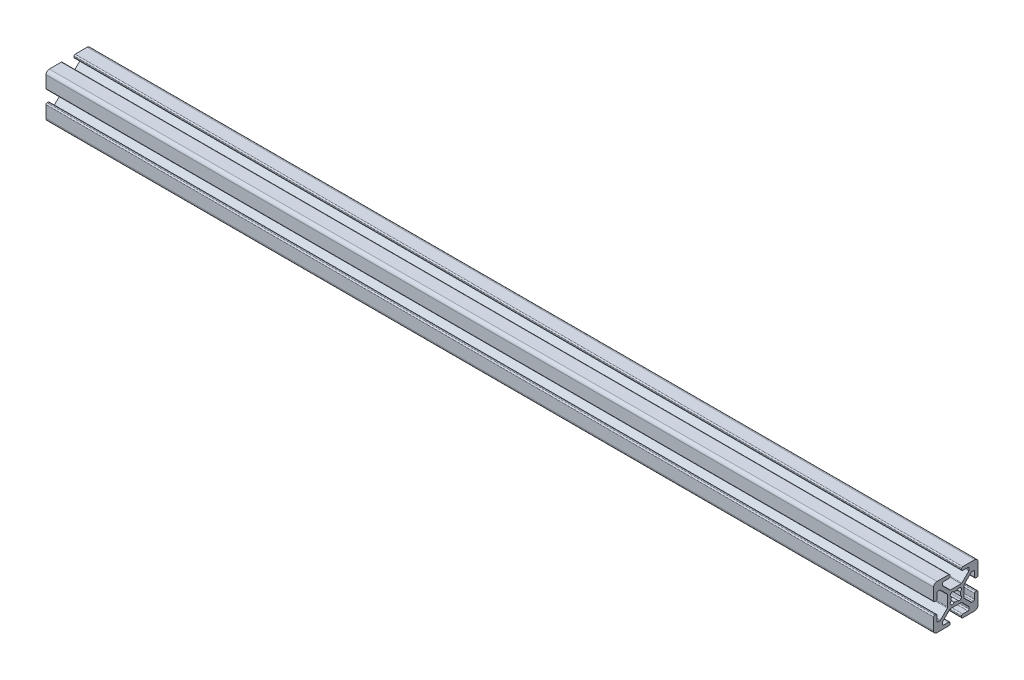
from build123d import *

# Parameters (mm, degrees)
LIB_FEAT_PART_SW_20X20_3_DEPTH = 400


with BuildPart() as part:
    # Sketch1 → Lib feat part (sw) 20X20(3) (new body)
    with BuildSketch(Plane.YZ):
        with BuildLine():
            Line((9.492, 2.63), (9.008, 2.63))
            ThreePointArc((9.008, 2.63), (8.648789755, 2.778789755), (8.5, 3.138))
            Line((8.5, 3.138), (8.5, 5.487))
            ThreePointArc((8.5, 5.487), (8.351210245, 5.846210245), (7.992, 5.995))
            Line((7.992, 5.995), (7.266080661, 5.995))
            ThreePointArc((7.266080661, 5.995), (7.071677478, 5.956330803), (6.906870417, 5.846210245))
            Line((6.906870417, 5.846210245), (3.803789755, 2.743129583))
            ThreePointArc((3.803789755, 2.743129583), (3.693669197, 2.578322522), (3.655, 2.383919339))
            Line((3.655, 2.383919339), (3.655, -2.383919339))
            ThreePointArc((3.655, -2.383919339), (3.693669197, -2.578322522), (3.803789755, -2.743129583))
            Line((3.803789755, -2.743129583), (6.906870417, -5.846210245))
            ThreePointArc((6.906870417, -5.846210245), (7.071677478, -5.956330803), (7.266080661, -5.995))
            Line((7.266080661, -5.995), (7.992, -5.995))
            ThreePointArc((7.992, -5.995), (8.351210245, -5.846210245), (8.5, -5.487))
            Line((8.5, -5.487), (8.5, -3.138))
            ThreePointArc((8.5, -3.138), (8.648789755, -2.778789755), (9.008, -2.63))
            Line((9.008, -2.63), (9.492, -2.63))
            ThreePointArc((9.492, -2.63), (9.851210245, -2.778789755), (10, -3.138))
            Line((10, -3.138), (10, -8.5))
            ThreePointArc((10, -8.5), (9.560660172, -9.560660172), (8.5, -10))
            Line((8.5, -10), (3.138, -10))
            ThreePointArc((3.138, -10), (2.778789755, -9.851210245), (2.63, -9.492))
            Line((2.63, -9.492), (2.63, -9.008))
            ThreePointArc((2.63, -9.008), (2.778789755, -8.648789755), (3.138, -8.5))
            Line((3.138, -8.5), (5.487, -8.5))
            ThreePointArc((5.487, -8.5), (5.846210245, -8.351210245), (5.995, -7.992))
            Line((5.995, -7.992), (5.995, -7.266080661))
            ThreePointArc((5.995, -7.266080661), (5.956330803, -7.071677478), (5.846210245, -6.906870417))
            Line((5.846210245, -6.906870417), (2.743129583, -3.803789755))
            ThreePointArc((2.743129583, -3.803789755), (2.578322522, -3.693669197), (2.383919339, -3.655))
            Line((2.383919339, -3.655), (-2.383919339, -3.655))
            ThreePointArc((-2.383919339, -3.655), (-2.578322522, -3.693669197), (-2.743129583, -3.803789755))
            Line((-2.743129583, -3.803789755), (-5.846210245, -6.906870417))
            ThreePointArc((-5.846210245, -6.906870417), (-5.956330803, -7.071677478), (-5.995, -7.266080661))
            Line((-5.995, -7.266080661), (-5.995, -7.992))
            ThreePointArc((-5.995, -7.992), (-5.846210245, -8.351210245), (-5.487, -8.5))
            Line((-5.487, -8.5), (-3.138, -8.5))
            ThreePointArc((-3.138, -8.5), (-2.778789755, -8.648789755), (-2.63, -9.008))
            Line((-2.63, -9.008), (-2.63, -9.492))
            ThreePointArc((-2.63, -9.492), (-2.778789755, -9.851210245), (-3.138, -10))
            Line((-3.138, -10), (-8.5, -10))
            ThreePointArc((-8.5, -10), (-9.560660172, -9.560660172), (-10, -8.5))
            Line((-10, -8.5), (-10, -3.138))
            ThreePointArc((-10, -3.138), (-9.851210245, -2.778789755), (-9.492, -2.63))
            Line((-9.492, -2.63), (-9.008, -2.63))
            ThreePointArc((-9.008, -2.63), (-8.648789755, -2.778789755), (-8.5, -3.138))
            Line((-8.5, -3.138), (-8.5, -5.487))
            ThreePointArc((-8.5, -5.487), (-8.351210245, -5.846210245), (-7.992, -5.995))
            Line((-7.992, -5.995), (-7.266080661, -5.995))
            ThreePointArc((-7.266080661, -5.995), (-7.071677478, -5.956330803), (-6.906870417, -5.846210245))
            Line((-6.906870417, -5.846210245), (-3.803789755, -2.743129583))
            ThreePointArc((-3.803789755, -2.743129583), (-3.693669197, -2.578322522), (-3.655, -2.383919339))
            Line((-3.655, -2.383919339), (-3.655, 2.383919339))
            ThreePointArc((-3.655, 2.383919339), (-3.693669197, 2.578322522), (-3.803789755, 2.743129583))
            Line((-3.803789755, 2.743129583), (-6.906870417, 5.846210245))
            ThreePointArc((-6.906870417, 5.846210245), (-7.071677478, 5.956330803), (-7.266080661, 5.995))
            Line((-7.266080661, 5.995), (-7.992, 5.995))
            ThreePointArc((-7.992, 5.995), (-8.351210245, 5.846210245), (-8.5, 5.487))
            Line((-8.5, 5.487), (-8.5, 3.138))
            ThreePointArc((-8.5, 3.138), (-8.648789755, 2.778789755), (-9.008, 2.63))
            Line((-9.008, 2.63), (-9.492, 2.63))
            ThreePointArc((-9.492, 2.63), (-9.851210245, 2.778789755), (-10, 3.138))
            Line((-10, 3.138), (-10, 8.5))
            ThreePointArc((-10, 8.5), (-9.560660172, 9.560660172), (-8.5, 10))
            Line((-8.5, 10), (-3.138, 10))
            ThreePointArc((-3.138, 10), (-2.778789755, 9.851210245), (-2.63, 9.492))
            Line((-2.63, 9.492), (-2.63, 9.008))
            ThreePointArc((-2.63, 9.008), (-2.778789755, 8.648789755), (-3.138, 8.5))
            Line((-3.138, 8.5), (-5.487, 8.5))
            ThreePointArc((-5.487, 8.5), (-5.846210245, 8.351210245), (-5.995, 7.992))
            Line((-5.995, 7.992), (-5.995, 7.266080661))
            ThreePointArc((-5.995, 7.266080661), (-5.956330803, 7.071677478), (-5.846210245, 6.906870417))
            Line((-5.846210245, 6.906870417), (-2.743129583, 3.803789755))
            ThreePointArc((-2.743129583, 3.803789755), (-2.578322522, 3.693669197), (-2.383919339, 3.655))
            Line((-2.383919339, 3.655), (2.383919339, 3.655))
            ThreePointArc((2.383919339, 3.655), (2.578322522, 3.693669197), (2.743129583, 3.803789755))
            Line((2.743129583, 3.803789755), (5.846210245, 6.906870417))
            ThreePointArc((5.846210245, 6.906870417), (5.956330803, 7.071677478), (5.995, 7.266080661))
            Line((5.995, 7.266080661), (5.995, 7.992))
            ThreePointArc((5.995, 7.992), (5.846210245, 8.351210245), (5.487, 8.5))
            Line((5.487, 8.5), (3.138, 8.5))
            ThreePointArc((3.138, 8.5), (2.778789755, 8.648789755), (2.63, 9.008))
            Line((2.63, 9.008), (2.63, 9.492))
            ThreePointArc((2.63, 9.492), (2.778789755, 9.851210245), (3.138, 10))
            Line((3.138, 10), (8.5, 10))
            ThreePointArc((8.5, 10), (9.560660172, 9.560660172), (10, 8.5))
            Line((10, 8.5), (10, 3.138))
            ThreePointArc((10, 3.138), (9.851210245, 2.778789755), (9.492, 2.63))
        make_face()
        with BuildLine():
            Line((2.124900844, -2.304505966), (2.304505966, -2.124900844))
            ThreePointArc((2.304505966, -2.124900844), (2.505938017, -1.356467811), (1.935133506, -0.803976718))
            ThreePointArc((1.935133506, -0.803976718), (2.0955, 0), (1.935133506, 0.803976718))
            ThreePointArc((1.935133506, 0.803976718), (2.505938017, 1.356467811), (2.304505966, 2.124900844))
            Line((2.304505966, 2.124900844), (2.124900844, 2.304505966))
            ThreePointArc((2.124900844, 2.304505966), (1.356467811, 2.505938017), (0.803976718, 1.935133506))
            ThreePointArc((0.803976718, 1.935133506), (0, 2.0955), (-0.803976718, 1.935133506))
            ThreePointArc((-0.803976718, 1.935133506), (-1.356467811, 2.505938017), (-2.124900844, 2.304505966))
            Line((-2.124900844, 2.304505966), (-2.304505966, 2.124900844))
            ThreePointArc((-2.304505966, 2.124900844), (-2.505938017, 1.356467811), (-1.935133506, 0.803976718))
            ThreePointArc((-1.935133506, 0.803976718), (-2.0955, 0), (-1.935133506, -0.803976718))
            ThreePointArc((-1.935133506, -0.803976718), (-2.505938017, -1.356467811), (-2.304505966, -2.124900844))
            Line((-2.304505966, -2.124900844), (-2.124900844, -2.304505966))
            ThreePointArc((-2.124900844, -2.304505966), (-1.356467811, -2.505938017), (-0.803976718, -1.935133506))
            ThreePointArc((-0.803976718, -1.935133506), (0, -2.0955), (0.803976718, -1.935133506))
            ThreePointArc((0.803976718, -1.935133506), (1.356467811, -2.505938017), (2.124900844, -2.304505966))
        make_face(mode=Mode.SUBTRACT)
    extrude(amount=LIB_FEAT_PART_SW_20X20_3_DEPTH)


solid = part.part
